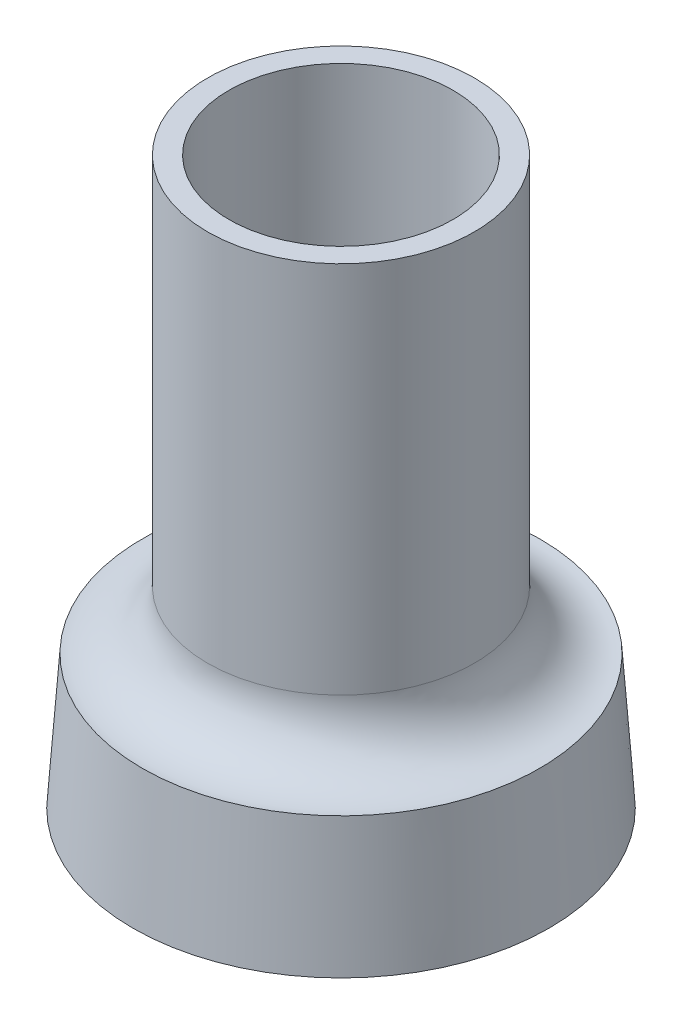
from build123d import *


with BuildPart() as part:
    # Szkic2 → Obrót-cienka ścianka3 (revolve)
    with BuildSketch(Plane(origin=(0, 0, 0), x_dir=(0, 0, -1), z_dir=(1, 0, 0))):
        with BuildLine():
            Line((1.25, 5.3), (1.25, 1.8))
            ThreePointArc((1.25, 1.8), (1.433795811, 1.38964102), (1.862343608, 1.25354481))
            Line((1.862343608, 1.25354481), (1.95, 0))
            Line((1.95, 0), (1.75048719, -0.013951295))
            Line((1.75048719, -0.013951295), (1.675359173, 1.060429406))
            ThreePointArc((1.675359173, 1.060429406), (1.227295617, 1.315737995), (1.05, 1.8))
            Line((1.05, 1.8), (1.05, 5.3))
            Line((1.05, 5.3), (1.25, 5.3))
        make_face()
    revolve(axis=Axis((0, 0, 0), (0, 1, 0)))


solid = part.part
